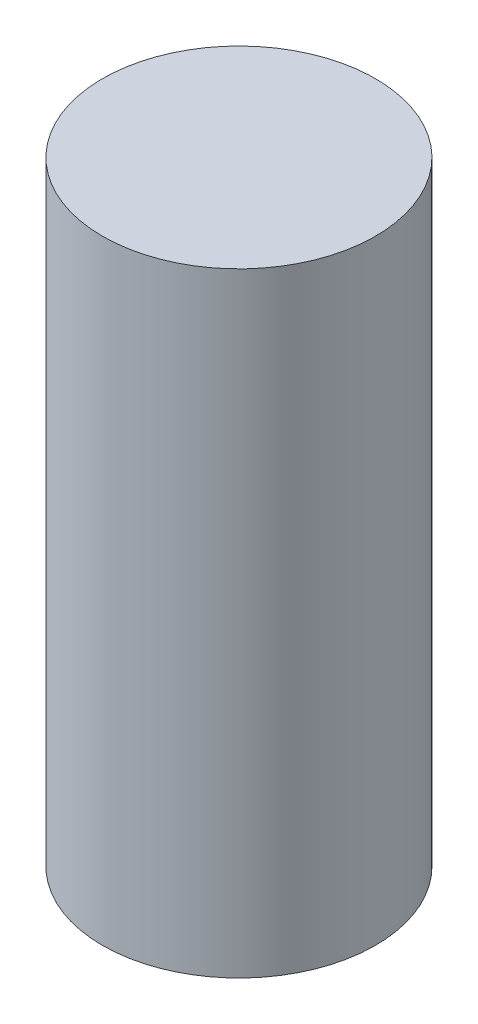
from build123d import *

# Parameters (mm, degrees)
SKETCH1_R           = 4
BOSS_EXTRUDE1_DEPTH = 18


with BuildPart() as part:
    # Sketch1 → Boss-Extrude1 (new body)
    with BuildSketch(Plane(origin=(0, 0, 0), x_dir=(1, 0, 0), z_dir=(0, 1, 0))):
        with Locations(Location((0, 0, 0), (0, 0, 270))):
            Circle(SKETCH1_R)
    extrude(amount=BOSS_EXTRUDE1_DEPTH)


solid = part.part
